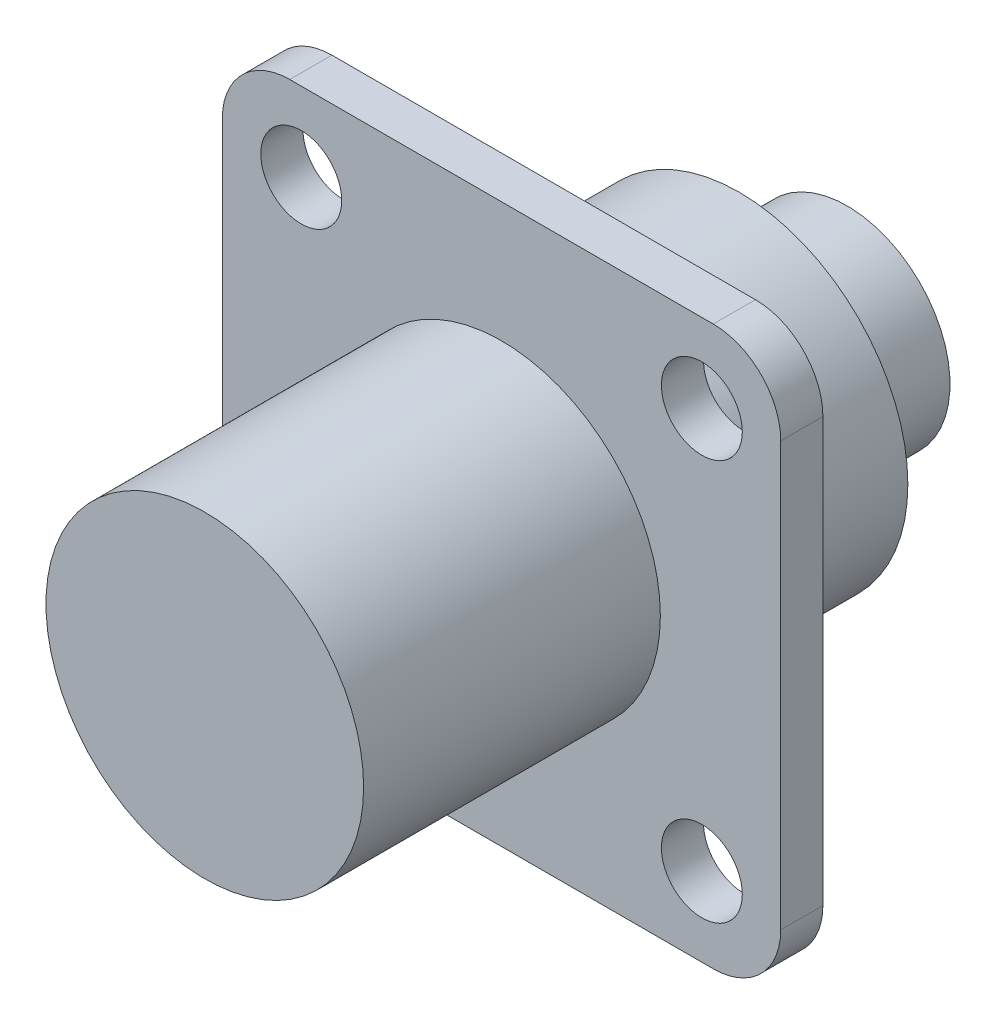
from build123d import *

# Parameters (mm, degrees)
SKETCH1_W           = 21.0312
SKETCH1_H           = 21.0312
BOSS_EXTRUDE1_DEPTH = 1.5875
SKETCH2_R           = 1.524
CUT_EXTRUDE1_DEPTH  = 15.9557963
FILLET1_R           = 2.54
SKETCH3_R           = 5.9817
BOSS_EXTRUDE2_DEPTH = 11.176
SKETCH4_R           = 6.35
BOSS_EXTRUDE3_DEPTH = 7.366
SKETCH5_R           = 3.8735
BOSS_EXTRUDE4_DEPTH = 4.064


with BuildPart() as part:
    # Sketch1 → Boss-Extrude1 (new body)
    with BuildSketch(Plane.XY):
        Rectangle(SKETCH1_W, SKETCH1_H)
    extrude(amount=BOSS_EXTRUDE1_DEPTH)

    # Sketch2 → Cut-Extrude1 (cut, through all)
    with BuildSketch(Plane.XY.offset(1.5875)):
        with Locations((-7.5438, 7.5438)):
            Circle(SKETCH2_R)
        with Locations((-7.5438, -7.5438)):
            Circle(SKETCH2_R)
        with Locations((7.5438, -7.5438)):
            Circle(SKETCH2_R)
        with Locations((7.5438, 7.5438)):
            Circle(SKETCH2_R)
    extrude(amount=-CUT_EXTRUDE1_DEPTH, mode=Mode.SUBTRACT)

    # Fillet1
    fillet1_edges = [part.edges().sort_by_distance(p)[0] for p in [
        (10.5156, -10.5156, 0.79375),
        (-10.5156, -10.5156, 0.79375),
        (-10.5156, 10.5156, 0.79375),
        (10.5156, 10.5156, 0.79375),
    ]]
    fillet(fillet1_edges, radius=FILLET1_R)

    # Sketch3 → Boss-Extrude2 (add)
    with BuildSketch(Plane.XY.offset(1.5875)):
        Circle(SKETCH3_R)
    extrude(amount=BOSS_EXTRUDE2_DEPTH)

    # Sketch4 → Boss-Extrude3 (add)
    with BuildSketch(Plane(origin=(0, 0, 0), x_dir=(-1, 0, 0), z_dir=(0, 0, -1))):
        with Locations(Location((0, 0, 0), (0, 0, 180))):
            Circle(SKETCH4_R)
    extrude(amount=BOSS_EXTRUDE3_DEPTH)

    # Sketch5 → Boss-Extrude4 (add)
    with BuildSketch(Plane(origin=(0, 0, -7.366), x_dir=(-1, 0, 0), z_dir=(0, 0, -1))):
        Circle(SKETCH5_R)
    extrude(amount=BOSS_EXTRUDE4_DEPTH)


solid = part.part
